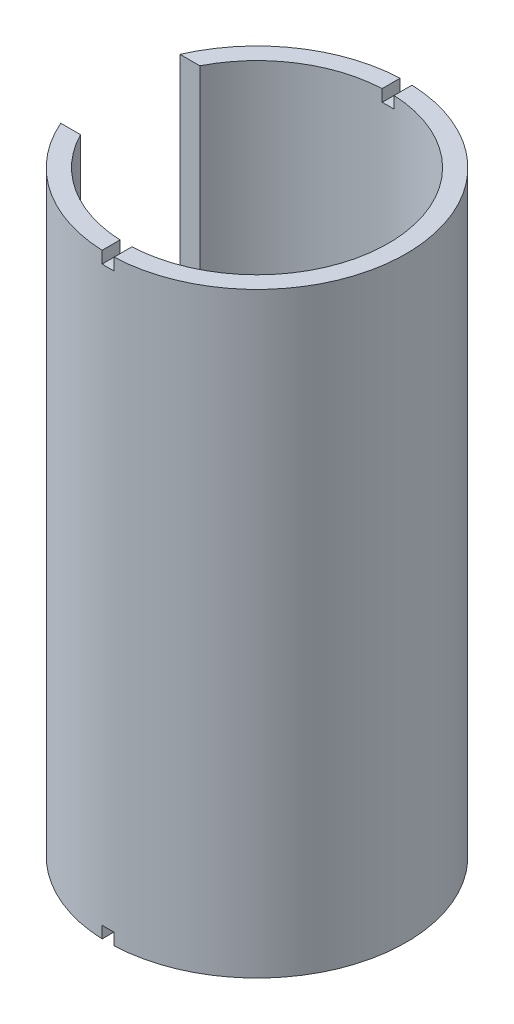
from build123d import *

# Parameters (mm, degrees)
SKETCH_1_R               = 25
SKETCH_1_R_2             = 22
EXTRUDE_1_DEPTH          = 100
CUT_EXTRUDE_1_DEPTH      = 107.066017178
CUT_EXTRUDE_1_DEPTH_BACK = 107.066017178
SKETCH_2_W               = 2
SKETCH_2_H               = 2
CUT_EXTRUDE_4_DEPTH      = 107.066017178
CUT_EXTRUDE_4_DEPTH_BACK = 107.066017178
SKETCH_3_W               = 30.652062969
SKETCH_3_H               = 20


with BuildPart() as part:
    # 草圖1 → 填料-伸長1 (new body)
    with BuildSketch(Plane(origin=(0, 0, 0), x_dir=(1, 0, 0), z_dir=(0, 1, 0))):
        with Locations(Location((0, 0, 0), (0, 0, 270))):
            Circle(SKETCH_1_R)
        with Locations(Location((0, 0, 0), (0, 0, 270))):
            Circle(SKETCH_1_R_2, mode=Mode.SUBTRACT)
    extrude(amount=EXTRUDE_1_DEPTH)

    # 草圖2 → 除料-伸長1 (cut, two sides: drawn at the far end of the back side and taken through both)
    with BuildSketch(Plane.XY.offset(-CUT_EXTRUDE_1_DEPTH_BACK)):
        with Locations((0, 99)):
            Rectangle(SKETCH_2_W, SKETCH_2_H)
        with Locations((0, 1)):
            Rectangle(SKETCH_2_W, SKETCH_2_H)
    extrude(amount=CUT_EXTRUDE_1_DEPTH + CUT_EXTRUDE_1_DEPTH_BACK, mode=Mode.SUBTRACT)

    # 草圖3 → 除料-伸長4 (cut, two sides: drawn at the far end of the back side and taken through both)
    with BuildSketch(Plane(origin=(0, 0, 0), x_dir=(1, 0, 0), z_dir=(0, 1, 0)).offset(-CUT_EXTRUDE_4_DEPTH_BACK)):
        with Locations((-28.265221999, 0)):
            Rectangle(SKETCH_3_W, SKETCH_3_H)
    extrude(amount=CUT_EXTRUDE_4_DEPTH + CUT_EXTRUDE_4_DEPTH_BACK, mode=Mode.SUBTRACT)


solid = part.part
